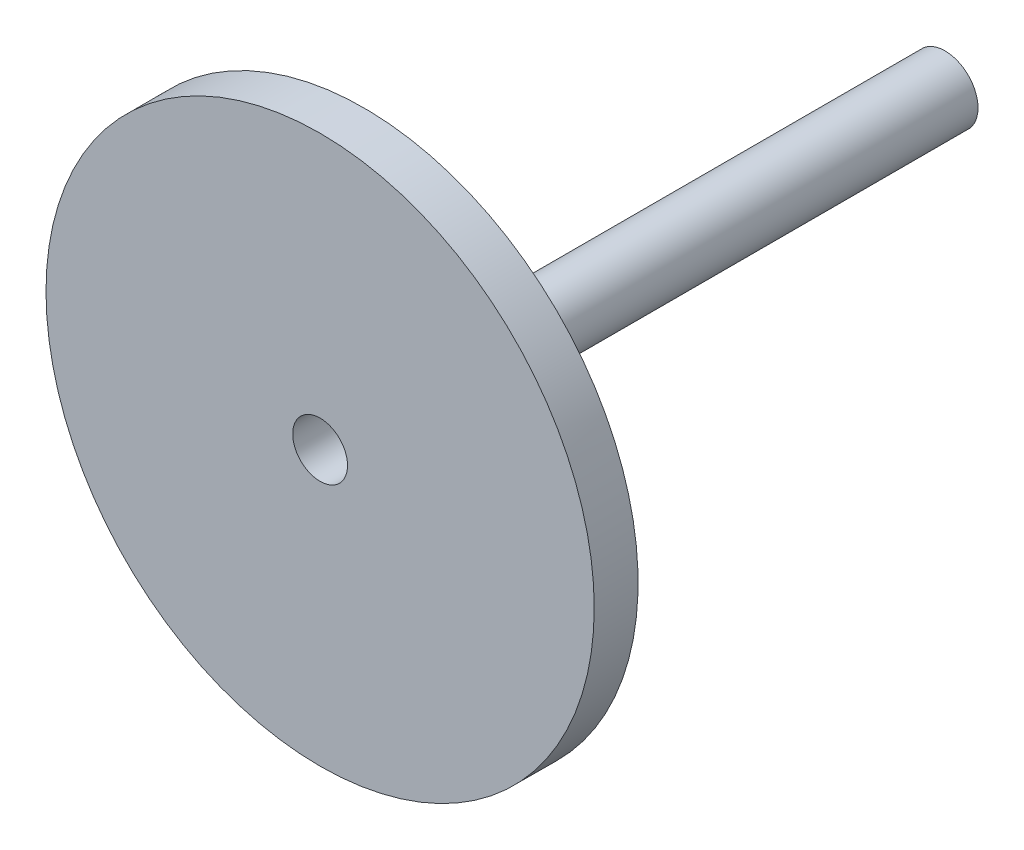
from build123d import *

# Parameters (mm, degrees)
SKETCH_1_R          = 2.5
EXTRUDE_1_DEPTH     = 0.2
EXTRUDE_START       = 0.2
SKETCH_3_R          = 2.5
SKETCH_3_R_2        = 2.4
EXTRUDE_2_DEPTH     = 0.2
SKETCH_4_R          = 1.75
SKETCH_4_R_2        = 1.65
CUT_EXTRUDE_1_DEPTH = 0.1
SKETCH_5_R          = 0.3
SKETCH_5_R_2        = 0.25
EXTRUDE_3_DEPTH     = 5.5
FILLET_1_R          = 0.03
CUT_EXTRUDE_START   = -5.5
SKETCH_11_R         = 0.25
CUT_EXTRUDE_3_DEPTH = 5.5


with BuildPart() as part:
    # 스케치1 → 보스-돌출1 (new body)
    with BuildSketch(Plane.XY):
        Circle(SKETCH_1_R)
    extrude(amount=EXTRUDE_1_DEPTH)

    # 스케치3 → 보스-돌출2 (add)
    with BuildSketch(Plane(origin=(0, 0, 0), x_dir=(-1, 0, 0), z_dir=(0, 0, -1)).offset(EXTRUDE_START)):
        Circle(SKETCH_3_R)
        Circle(SKETCH_3_R_2, mode=Mode.SUBTRACT)
    extrude(amount=-EXTRUDE_2_DEPTH)

    # 스케치4 → 컷-돌출1 (cut)
    with BuildSketch(Plane(origin=(0, 0, 0), x_dir=(-1, 0, 0), z_dir=(0, 0, -1))):
        Circle(SKETCH_4_R)
        Circle(SKETCH_4_R_2, mode=Mode.SUBTRACT)
    extrude(amount=-CUT_EXTRUDE_1_DEPTH, mode=Mode.SUBTRACT)

    # 스케치5 → 보스-돌출3 (add)
    with BuildSketch(Plane(origin=(0, 0, 0), x_dir=(-1, 0, 0), z_dir=(0, 0, -1))):
        with Locations(Location((0, 0, 0), (0, 0, 180))):
            Circle(SKETCH_5_R)
        Circle(SKETCH_5_R_2, mode=Mode.SUBTRACT)
    extrude(amount=EXTRUDE_3_DEPTH)

    # 스케치7 → 회전1 (revolve)
    with BuildSketch(Plane(origin=(0, 0, 0), x_dir=(1, 0, 0), z_dir=(0, 1, 0))):
        Polygon((0.3, 0), (0.3, 0.6), (0.365, 0.6), (0.5, 0), align=None)
    revolve(axis=Axis((0, 0, 0), (0, 0, -1)))

    # 필렛1
    fillet_1_edges = [part.edges().sort_by_distance(p)[0] for p in [
        (-0.365, 0, -0.6),
    ]]
    fillet(fillet_1_edges, radius=FILLET_1_R)

    # 스케치11 → 컷-돌출3 (cut)
    with BuildSketch(Plane(origin=(0, 0, 0), x_dir=(-1, 0, 0), z_dir=(0, 0, -1)).offset(CUT_EXTRUDE_START)):
        with Locations(Location((0, 0, 0), (0, 0, 180))):
            Circle(SKETCH_11_R)
    extrude(amount=CUT_EXTRUDE_3_DEPTH, mode=Mode.SUBTRACT)


solid = part.part
